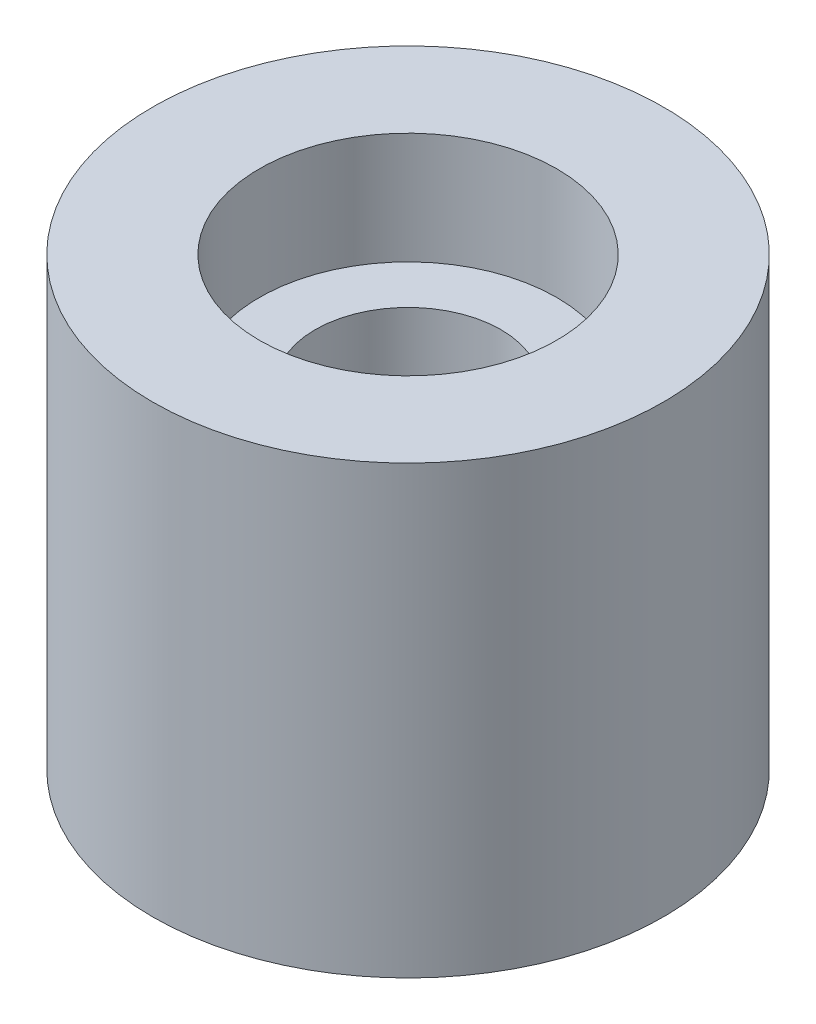
from build123d import *

# Parameters (mm, degrees)
SKETCH_1_R          = 2.75
EXTRUDE_1_DEPTH     = 4.8
SKETCH_2_R          = 1
CUT_EXTRUDE_1_DEPTH = 7.177782774
SKETCH_2_3_R        = 1.6
CUT_EXTRUDE_2_DEPTH = 1.2
CUT_EXTRUDE_START   = -3.6
SKETCH_2_4_R        = 1.6
CUT_EXTRUDE_3_DEPTH = 1.2


with BuildPart() as part:
    # 草图1 → 凸台-拉伸1 (new body)
    with BuildSketch(Plane(origin=(0, 0, 0), x_dir=(1, 0, 0), z_dir=(0, 1, 0))):
        with Locations(Location((0, 0, 0), (0, 0, 270))):
            Circle(SKETCH_1_R)
    extrude(amount=EXTRUDE_1_DEPTH)

    # 草图2 → 切除-拉伸1 (cut, through all)
    with BuildSketch(Plane(origin=(0, 4.8, 0), x_dir=(1, 0, 0), z_dir=(0, 1, 0))):
        with Locations(Location((0, 0, 0), (0, 0, 270))):
            Circle(SKETCH_2_R)
    extrude(amount=-CUT_EXTRUDE_1_DEPTH, mode=Mode.SUBTRACT)

    # 草图2<3> → 切除-拉伸2 (cut)
    with BuildSketch(Plane(origin=(0, 4.8, 0), x_dir=(1, 0, 0), z_dir=(0, 1, 0))):
        with Locations(Location((0, 0, 0), (0, 0, 270))):
            Circle(SKETCH_2_3_R)
    extrude(amount=-CUT_EXTRUDE_2_DEPTH, mode=Mode.SUBTRACT)

    # 草图2<4> → 切除-拉伸3 (cut)
    with BuildSketch(Plane(origin=(0, 4.8, 0), x_dir=(1, 0, 0), z_dir=(0, 1, 0)).offset(CUT_EXTRUDE_START)):
        with Locations(Location((0, 0, 0), (0, 0, 270))):
            Circle(SKETCH_2_4_R)
    extrude(amount=-CUT_EXTRUDE_3_DEPTH, mode=Mode.SUBTRACT)


solid = part.part
